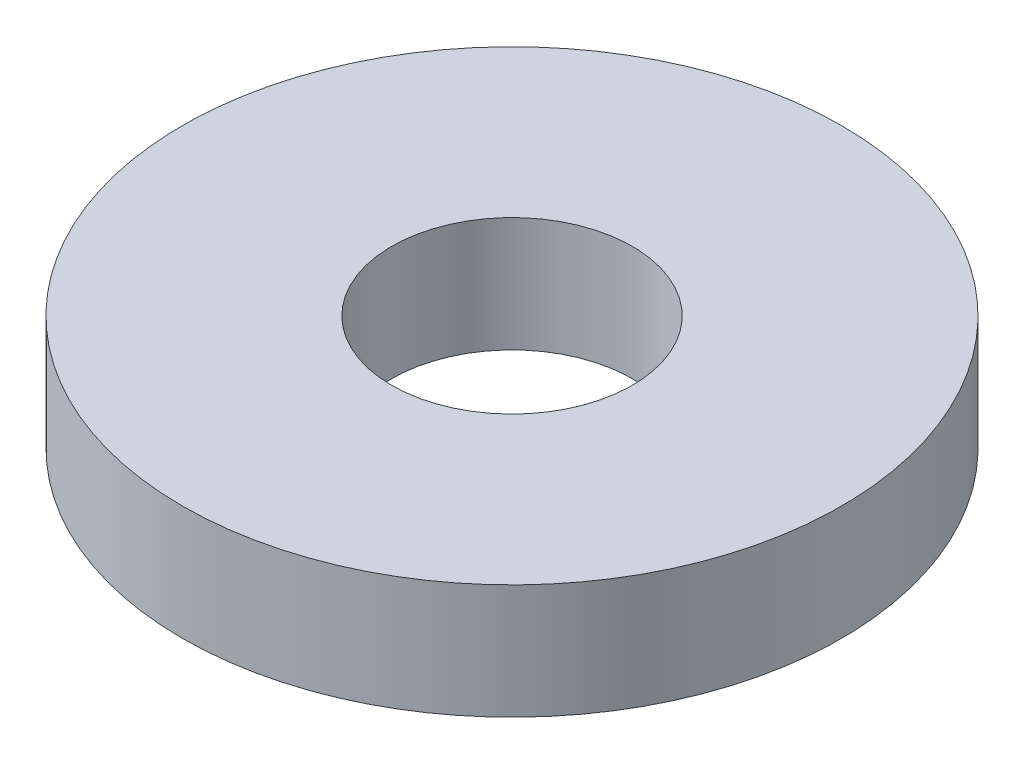
from build123d import *

# Parameters (mm, degrees)
SKETCH1_R           = 5.75
SKETCH1_R_2         = 2.1
BOSS_EXTRUDE1_DEPTH = 2


with BuildPart() as part:
    # Sketch1 → Boss-Extrude1 (new body)
    with BuildSketch(Plane(origin=(0, 0, 0), x_dir=(1, 0, 0), z_dir=(0, 1, 0))):
        with Locations(Location((0, 0, 0), (0, 0, 270))):
            Circle(SKETCH1_R)
        with Locations(Location((0, 0, 0), (0, 0, 270))):
            Circle(SKETCH1_R_2, mode=Mode.SUBTRACT)
    extrude(amount=BOSS_EXTRUDE1_DEPTH)


solid = part.part
